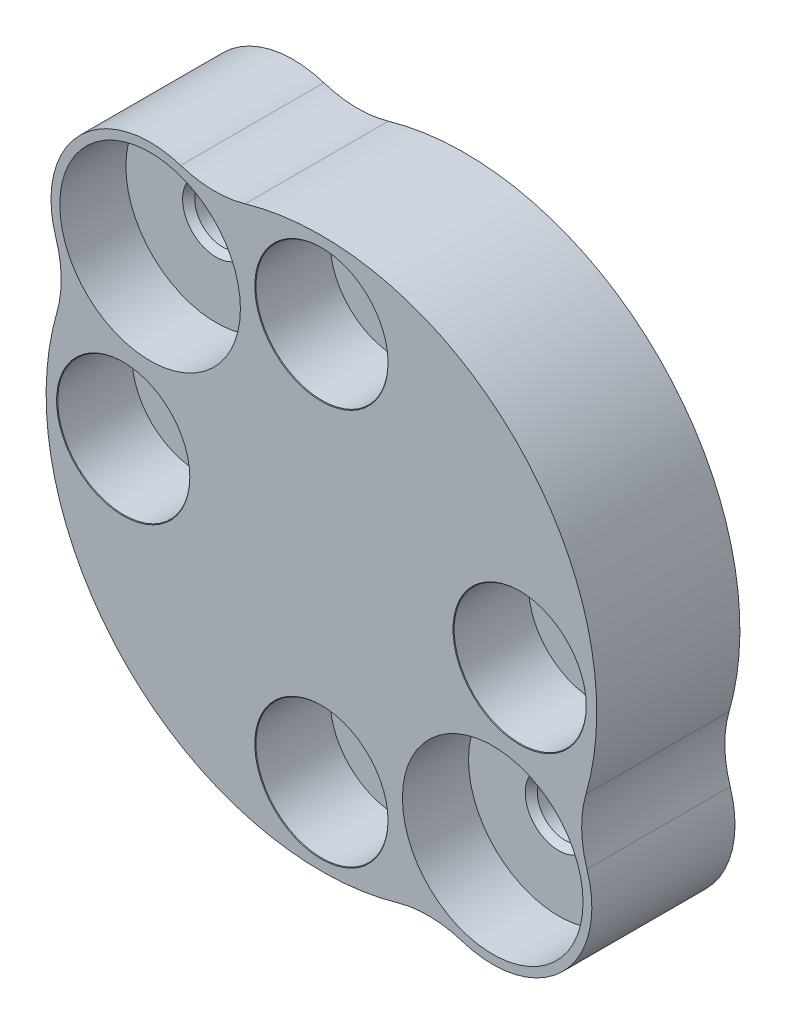
from build123d import *

# Parameters (mm, degrees)
SKETCH1_R                   = 12.5
BOSS_EXTRUDE1_DEPTH         = 6.5
CIRPATTERN1_COUNT           = 4
SKETCH5_R                   = 4.5
BOSS_EXTRUDE3_DEPTH         = 6.5
SKETCH7_R                   = 4.1
CUT_EXTRUDE2_DEPTH          = 3
CIRPATTERN3_COUNT           = 2
FILLET2_R                   = 5
M3_TAPPED_HOLE1_D           = 2.5
M3_TAPPED_HOLE1_CSINK_D     = 3.05
M3_TAPPED_HOLE1_CSINK_ANGLE = 90


with BuildPart() as part:
    # Sketch1 → Boss-Extrude1 (new body)
    with BuildSketch(Plane.XY):
        with Locations(Location((0, 0, 0), (0, 0, 180))):
            Circle(SKETCH1_R)
    extrude(amount=BOSS_EXTRUDE1_DEPTH)

    # Sketch4 → CBORE for M3 Hexagon socket head cap screws1 (revolve, cut)
    with BuildSketch(Plane(origin=(-9, 0, 6.5), x_dir=(0, -1, 0), z_dir=(1, 0, 0))):
        Polygon((0, 0), (0, 6.5), (1.6, 6.5), (1.6, 3.4), (3, 3.4), (3, 0.025), (3.025, 0), align=None)
    cbore_for_m3_hexagon_socket_head_cap_scr = revolve(axis=Axis((-9, 0, 12.85), (0, 0, -1)), mode=Mode.SUBTRACT)

    # CirPattern1: CBORE for M3 Hexagon socket head cap screws1 ×4 about axis
    cirpattern1_axis = Axis((0, 0, 0), (0, 0, 1))
    for i in range(1, CIRPATTERN1_COUNT):
        add(cbore_for_m3_hexagon_socket_head_cap_scr.rotate(cirpattern1_axis, i * 360 / CIRPATTERN1_COUNT), mode=Mode.SUBTRACT)

    # Sketch5 → Boss-Extrude3 (add)
    with BuildSketch(Plane.XY.offset(6.5)):
        with Locations((-7.778174593, 7.778174593)):
            Circle(SKETCH5_R)
    boss_extrude3 = extrude(amount=-BOSS_EXTRUDE3_DEPTH)

    # Sketch7 → Cut-Extrude2 (cut)
    with BuildSketch(Plane.XY.offset(6.5)):
        with Locations((-7.778174593, 7.778174593)):
            Circle(SKETCH7_R)
    cut_extrude2 = extrude(amount=-CUT_EXTRUDE2_DEPTH, mode=Mode.SUBTRACT)

    # CirPattern3: Boss-Extrude3, Cut-Extrude2 ×2 about axis
    cirpattern3_axis = Axis((0, 0, 0), (0, 0, 1))
    add([boss_extrude3.rotate(cirpattern3_axis, i * 360 / CIRPATTERN3_COUNT) for i in range(1, CIRPATTERN3_COUNT)])
    add([cut_extrude2.rotate(cirpattern3_axis, i * 360 / CIRPATTERN3_COUNT) for i in range(1, CIRPATTERN3_COUNT)], mode=Mode.SUBTRACT)

    # Fillet2
    fillet2_edges = [part.edges().sort_by_distance(p)[0] for p in [
        (-5.115048509, 11.405537197, 3.25),
        (-11.405537197, 5.115048509, 3.25),
        (5.115048509, -11.405537197, 3.25),
        (11.405537197, -5.115048509, 3.25),
    ]]
    fillet(fillet2_edges, radius=FILLET2_R)

    # M3 Tapped Hole1 (through all)
    with Locations(Plane(origin=(-7.778174593, 7.778174593, 3.5), x_dir=(1, 0, 0), z_dir=(0, 0, 1))):
        with Locations((0, 0), (15.556349186, -15.556349186)):
            CounterSinkHole(M3_TAPPED_HOLE1_D / 2, M3_TAPPED_HOLE1_CSINK_D / 2, counter_sink_angle=M3_TAPPED_HOLE1_CSINK_ANGLE)


solid = part.part
